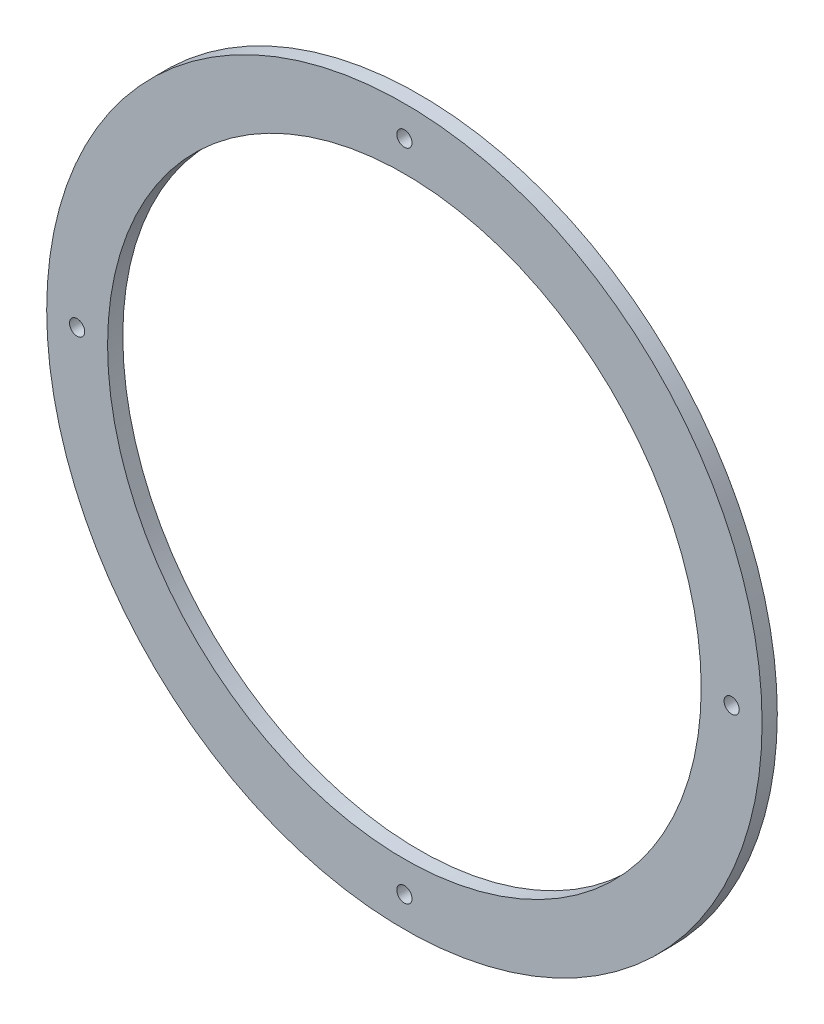
from build123d import *

# Parameters (mm, degrees)
SKETCH1_R           = 149.225
SKETCH1_R_2         = 123.825
SKETCH1_R_3         = 3.175
BOSS_EXTRUDE1_DEPTH = 6.35


with BuildPart() as part:
    # Sketch1 → Boss-Extrude1 (new body)
    with BuildSketch(Plane.XY):
        Circle(SKETCH1_R)
        Circle(SKETCH1_R_2, mode=Mode.SUBTRACT)
        with Locations((0, 136.525)):
            Circle(SKETCH1_R_3, mode=Mode.SUBTRACT)
        with Locations((136.525, 0)):
            Circle(SKETCH1_R_3, mode=Mode.SUBTRACT)
        with Locations((0, -136.525)):
            Circle(SKETCH1_R_3, mode=Mode.SUBTRACT)
        with Locations((-136.525, 0)):
            Circle(SKETCH1_R_3, mode=Mode.SUBTRACT)
    extrude(amount=BOSS_EXTRUDE1_DEPTH)


solid = part.part
